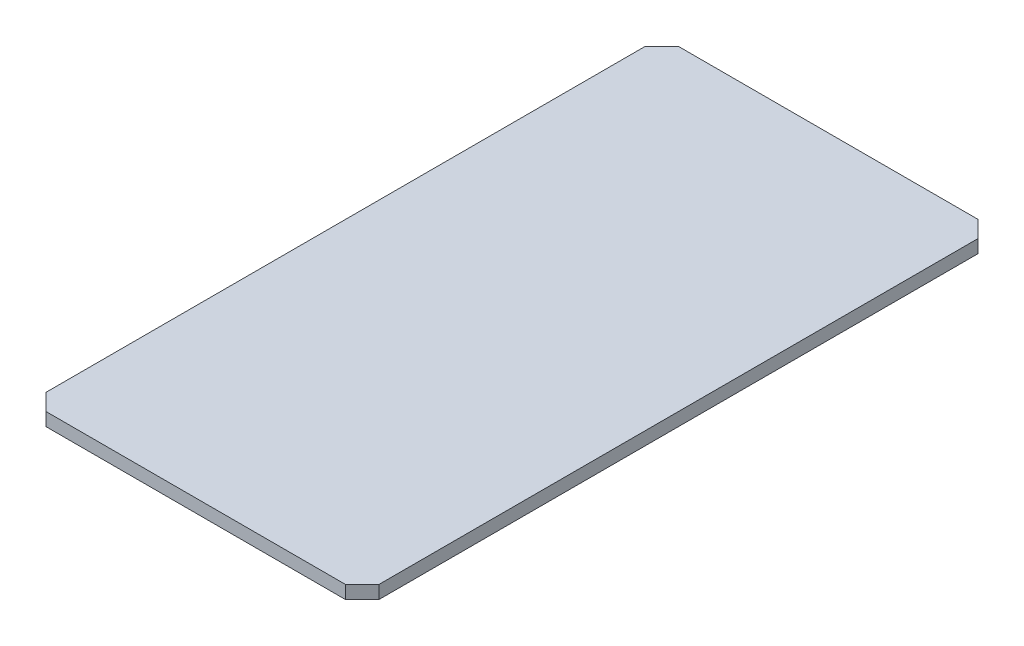
from build123d import *

# Parameters (mm, degrees)
BOSS_EXTRUDE1_DEPTH = 1


with BuildPart() as part:
    # Sketch1 → Boss-Extrude1 (new body)
    with BuildSketch(Plane(origin=(0, 0, 0), x_dir=(1, 0, 0), z_dir=(0, 1, 0))):
        Polygon((-31.410048731, 35.584506185), (-30.140048731, 36.854506185), (-7.280048731, 36.854506185), (-6.010048731, 35.584506185), (-6.010048731, -10.135493815), (-7.280048731, -11.405493815), (-30.140048731, -11.405493815), (-31.410048731, -10.135493815), align=None)
    extrude(amount=BOSS_EXTRUDE1_DEPTH)


solid = part.part
